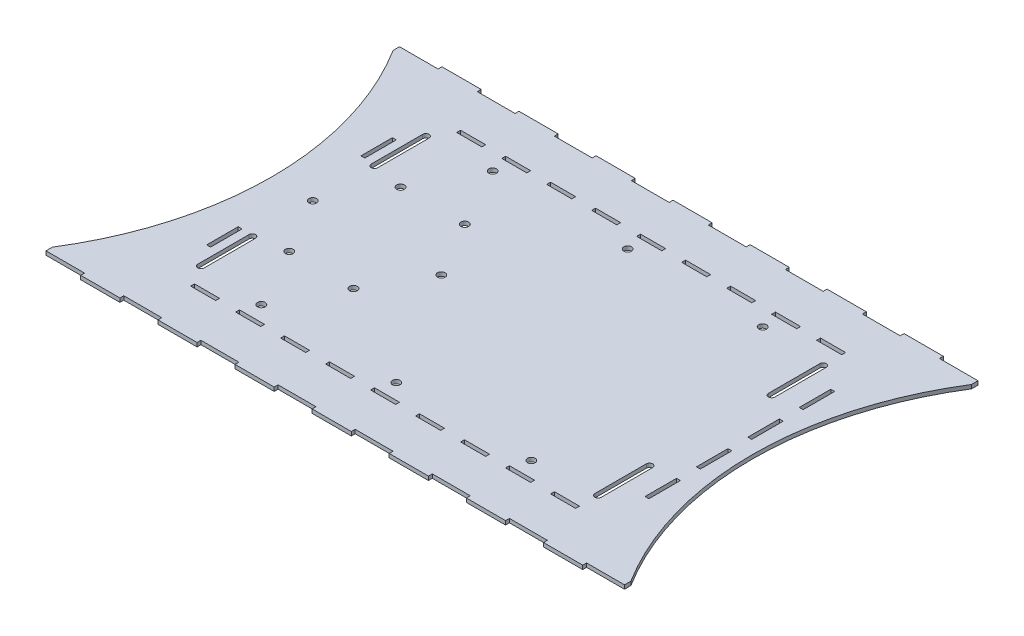
from build123d import *

# Parameters (mm, degrees)
SKETCH2_W           = 450
SKETCH2_H           = 275
BOSS_EXTRUDE1_DEPTH = 3
SKETCH18_R          = 3
CUT_EXTRUDE8_DEPTH  = 15.5
SKETCH19_R          = 3
CUT_EXTRUDE9_DEPTH  = 10
SKETCH20_W          = 19.5
SKETCH20_H          = 3
SKETCH20_W_2        = 3
SKETCH20_H_2        = 24.5
CUT_EXTRUDE10_DEPTH = 4.5
SKETCH23_W          = 30.5
SKETCH23_H          = 3
BOSS_EXTRUDE3_DEPTH = 3
CUT_EXTRUDE18_DEPTH = 253


with BuildPart() as part:
    # Sketch2 → Boss-Extrude1 (new body)
    with BuildSketch(Plane(origin=(0, 0, 0), x_dir=(1, 0, 0), z_dir=(0, 1, 0))):
        with Locations((225, 137.5)):
            Rectangle(SKETCH2_W, SKETCH2_H)
    extrude(amount=BOSS_EXTRUDE1_DEPTH)

    # Sketch18 → Cut-Extrude8 (cut, symmetric)
    with BuildSketch(Plane.XZ):
        with Locations(Location((120, -47.5, 0), (0, 0, 270))):
            Circle(SKETCH18_R)
        with Locations(Location((225, -47.5, 0), (0, 0, 270))):
            Circle(SKETCH18_R)
        with Locations(Location((330, -47.5, 0), (0, 0, 270))):
            Circle(SKETCH18_R)
        with Locations(Location((330, -227.5, 0), (0, 0, 270))):
            Circle(SKETCH18_R)
        with Locations(Location((225, -227.5, 0), (0, 0, 270))):
            Circle(SKETCH18_R)
        with Locations(Location((120, -227.5, 0), (0, 0, 270))):
            Circle(SKETCH18_R)
    extrude(amount=CUT_EXTRUDE8_DEPTH, both=True, mode=Mode.SUBTRACT)

    # Sketch19 → Cut-Extrude9 (cut)
    with BuildSketch(Plane(origin=(0, 3, 0), x_dir=(1, 0, 0), z_dir=(0, 1, 0))):
        with Locations(Location((70, 137.5, 0), (0, 0, 270))):
            Circle(SKETCH19_R)
        with Locations(Location((95, 180.801270189, 0), (0, 0, 270))):
            Circle(SKETCH19_R)
        with Locations(Location((145, 180.801270189, 0), (0, 0, 270))):
            Circle(SKETCH19_R)
        with Locations(Location((170, 137.5, 0), (0, 0, 270))):
            Circle(SKETCH19_R)
        with Locations(Location((145, 94.198729811, 0), (0, 0, 270))):
            Circle(SKETCH19_R)
        with Locations(Location((95, 94.198729811, 0), (0, 0, 270))):
            Circle(SKETCH19_R)
    extrude(amount=-CUT_EXTRUDE9_DEPTH, mode=Mode.SUBTRACT)

    # Sketch20 → Cut-Extrude10 (cut, symmetric)
    with BuildSketch(Plane(origin=(0, 3, 0), x_dir=(1, 0, 0), z_dir=(0, 1, 0))):
        with Locations((124.75, 241)):
            Rectangle(SKETCH20_W, SKETCH20_H)
        with BuildLine():
            Line((68.023450962, 89.983493695), (68.023450962, 49.983493695))
            ThreePointArc((68.023450962, 49.983493695), (70.523450962, 47.483493695), (73.023450962, 49.983493695))
            Line((73.023450962, 49.983493695), (73.023450962, 89.983493695))
            ThreePointArc((73.023450962, 89.983493695), (70.523450962, 92.483493695), (68.023450962, 89.983493695))
        make_face()
        with BuildLine():
            ThreePointArc((73.023450962, 225.016506305), (70.523450962, 227.516506305), (68.023450962, 225.016506305))
            Line((68.023450962, 225.016506305), (68.023450962, 185.016506305))
            ThreePointArc((68.023450962, 185.016506305), (70.523450962, 182.516506305), (73.023450962, 185.016506305))
            Line((73.023450962, 185.016506305), (73.023450962, 225.016506305))
        make_face()
        with BuildLine():
            Line((381.976549038, 185.016506305), (381.976549038, 225.016506305))
            ThreePointArc((381.976549038, 225.016506305), (379.476549038, 227.516506305), (376.976549038, 225.016506305))
            Line((376.976549038, 225.016506305), (376.976549038, 185.016506305))
            ThreePointArc((376.976549038, 185.016506305), (379.476549038, 182.516506305), (381.976549038, 185.016506305))
        make_face()
        with BuildLine():
            ThreePointArc((376.976549038, 49.983493695), (379.476549038, 47.483493695), (381.976549038, 49.983493695))
            Line((381.976549038, 49.983493695), (381.976549038, 89.983493695))
            ThreePointArc((381.976549038, 89.983493695), (379.476549038, 92.483493695), (376.976549038, 89.983493695))
            Line((376.976549038, 89.983493695), (376.976549038, 49.983493695))
        make_face()
        with Locations((400, 199.75)):
            Rectangle(SKETCH20_W_2, SKETCH20_H_2)
        with Locations((89.75, 241)):
            Rectangle(SKETCH20_W, SKETCH20_H)
        with Locations((159.75, 241)):
            Rectangle(SKETCH20_W, SKETCH20_H)
        with Locations((194.75, 241)):
            Rectangle(SKETCH20_W, SKETCH20_H)
        with Locations((229.75, 241)):
            Rectangle(SKETCH20_W, SKETCH20_H)
        with Locations((264.75, 241)):
            Rectangle(SKETCH20_W, SKETCH20_H)
        with Locations((299.75, 241)):
            Rectangle(SKETCH20_W, SKETCH20_H)
        with Locations((334.75, 241)):
            Rectangle(SKETCH20_W, SKETCH20_H)
        with Locations((369.75, 241)):
            Rectangle(SKETCH20_W, SKETCH20_H)
        with Locations((400, 159.75)):
            Rectangle(SKETCH20_W_2, SKETCH20_H_2)
        with Locations((400, 119.75)):
            Rectangle(SKETCH20_W_2, SKETCH20_H_2)
        with Locations((400, 79.75)):
            Rectangle(SKETCH20_W_2, SKETCH20_H_2)
        with Locations((264.75, 34)):
            Rectangle(SKETCH20_W, SKETCH20_H)
        with Locations((229.75, 34)):
            Rectangle(SKETCH20_W, SKETCH20_H)
        with Locations((194.75, 34)):
            Rectangle(SKETCH20_W, SKETCH20_H)
        with Locations((159.75, 34)):
            Rectangle(SKETCH20_W, SKETCH20_H)
        with Locations((124.75, 34)):
            Rectangle(SKETCH20_W, SKETCH20_H)
        with Locations((89.75, 34)):
            Rectangle(SKETCH20_W, SKETCH20_H)
        with Locations((369.75, 34)):
            Rectangle(SKETCH20_W, SKETCH20_H)
        with Locations((334.75, 34)):
            Rectangle(SKETCH20_W, SKETCH20_H)
        with Locations((299.75, 34)):
            Rectangle(SKETCH20_W, SKETCH20_H)
        with Locations((60, 198.75)):
            Rectangle(SKETCH20_W_2, SKETCH20_H_2)
        with Locations((60, 78.75)):
            Rectangle(SKETCH20_W_2, SKETCH20_H_2)
    extrude(amount=CUT_EXTRUDE10_DEPTH, both=True, mode=Mode.SUBTRACT)

    # Sketch23 → Boss-Extrude3 (add)
    with BuildSketch(Plane(origin=(0, 3, 0), x_dir=(1, 0, 0), z_dir=(0, 1, 0))):
        with Locations((45.25, 276.5)):
            Rectangle(SKETCH23_W, SKETCH23_H)
        with Locations((105.166666667, 276.5)):
            Rectangle(SKETCH23_W, SKETCH23_H)
        with Locations((165.083333333, 276.5)):
            Rectangle(SKETCH23_W, SKETCH23_H)
        with Locations((225, 276.5)):
            Rectangle(SKETCH23_W, SKETCH23_H)
        with Locations((284.916666667, 276.5)):
            Rectangle(SKETCH23_W, SKETCH23_H)
        with Locations((344.833333333, 276.5)):
            Rectangle(SKETCH23_W, SKETCH23_H)
        with Locations((404.75, 276.5)):
            Rectangle(SKETCH23_W, SKETCH23_H)
        with Locations((405.25, -1.5)):
            Rectangle(SKETCH23_W, SKETCH23_H)
        with Locations((345.25, -1.5)):
            Rectangle(SKETCH23_W, SKETCH23_H)
        with Locations((285.25, -1.5)):
            Rectangle(SKETCH23_W, SKETCH23_H)
        with Locations((225.25, -1.5)):
            Rectangle(SKETCH23_W, SKETCH23_H)
        with Locations((165.25, -1.5)):
            Rectangle(SKETCH23_W, SKETCH23_H)
        with Locations((105.25, -1.5)):
            Rectangle(SKETCH23_W, SKETCH23_H)
        with Locations((45.25, -1.5)):
            Rectangle(SKETCH23_W, SKETCH23_H)
    extrude(amount=-BOSS_EXTRUDE3_DEPTH)

    # Sketch28 → Cut-Extrude18 (cut)
    with BuildSketch(Plane(origin=(0, 3, 0), x_dir=(1, 0, 0), z_dir=(0, 1, 0))):
        with BuildLine():
            Line((0, 270), (0, 5))
            ThreePointArc((0, 5), (38.000589623, 137.5), (0, 270))
        make_face()
        with BuildLine():
            Line((450, 270), (450, 5))
            ThreePointArc((450, 5), (411.999410377, 137.5), (450, 270))
        make_face()
    extrude(amount=-CUT_EXTRUDE18_DEPTH, mode=Mode.SUBTRACT)


solid = part.part
